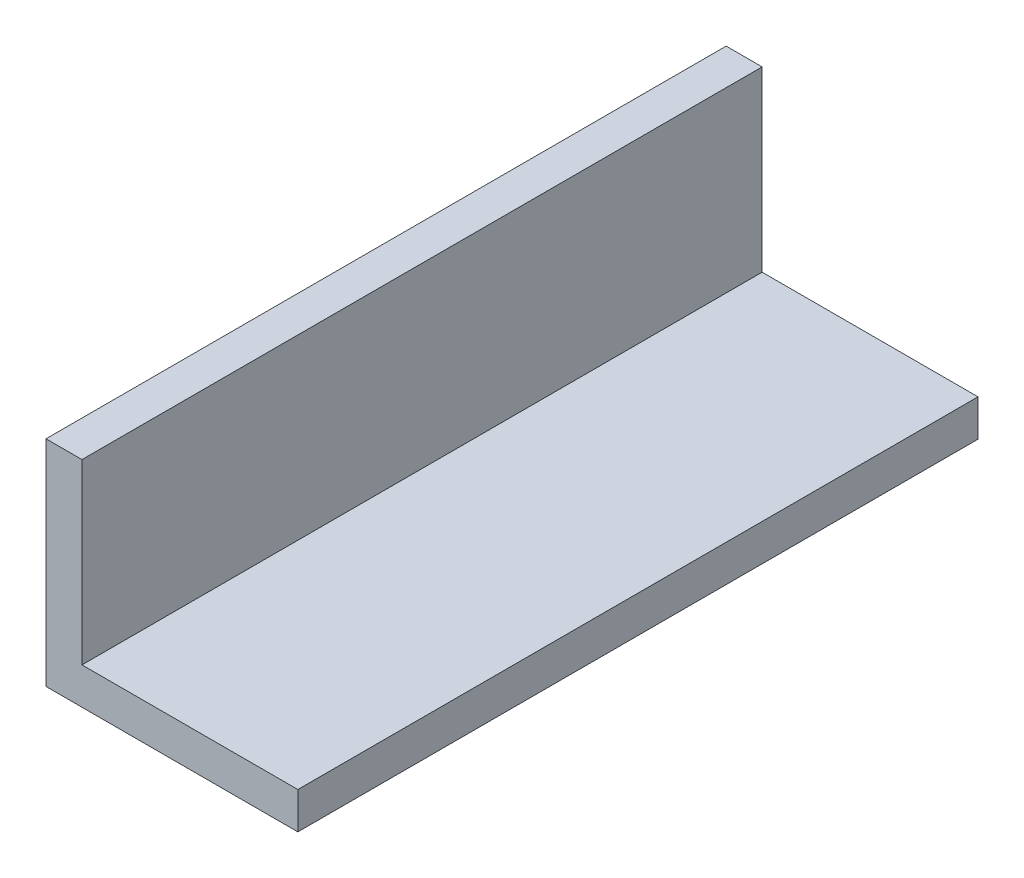
from build123d import *

# Parameters (mm, degrees)
BOSS_EXTRU_1_DEPTH = 191.46


with BuildPart() as part:
    # Esquisse1 → Boss.-Extru.1 (new body)
    with BuildSketch(Plane.XY):
        Polygon((0, 0), (70.894031532, 0), (70.894031532, 10.334313725), (10.133247218, 10.334313725), (10.133247218, 60.387254902), (0, 60.387254902), align=None)
    extrude(amount=BOSS_EXTRU_1_DEPTH)


solid = part.part
